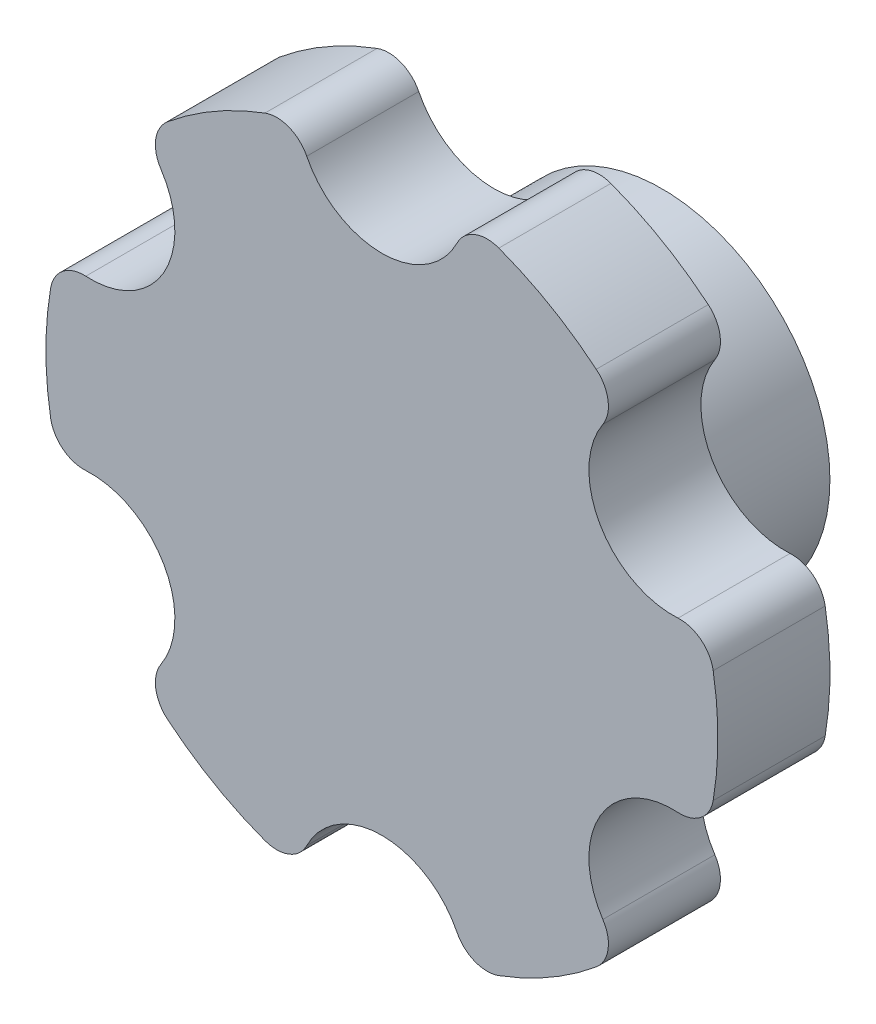
from build123d import *

# Parameters (mm, degrees)
IZIM1_R                        = 15
Y_KSEKLIK_EKSTR_ZYON1_DEPTH    = 15
IZIM2_R                        = 30
Y_KSEKLIK_EKSTR_ZYON2_DEPTH    = 10
IZIM3_R                        = 7.5
KES_EKSTR_ZYON1_DEPTH          = 10
RADYUS1_R                      = 3
DAIRESEL_KAPLAMA3_COUNT        = 6
RADYUS1_OF_DAIRESEL_KAPLAMA3_R = 3
IZIM4_R                        = 4.25
KES_EKSTR_ZYON2_DEPTH          = 15


with BuildPart() as part:
    # Çizim1 → Yükseklik-Ekstrüzyon1 (new body)
    with BuildSketch(Plane.XY):
        Circle(IZIM1_R)
    extrude(amount=Y_KSEKLIK_EKSTR_ZYON1_DEPTH)

    # Çizim2 → Yükseklik-Ekstrüzyon2 (add)
    with BuildSketch(Plane.XY.offset(15)):
        Circle(IZIM2_R)
    extrude(amount=Y_KSEKLIK_EKSTR_ZYON2_DEPTH)

    # Çizim3 → Kes-Ekstrüzyon1 (cut)
    with BuildSketch(Plane.XY.offset(25)):
        with Locations((0, 30)):
            Circle(IZIM3_R)
    kes_ekstr_zyon1 = extrude(amount=-KES_EKSTR_ZYON1_DEPTH, mode=Mode.SUBTRACT)

    # Radyus1
    radyus1_edges = [part.edges().sort_by_distance(p)[0] for p in [
        (7.441175562, 29.0625, 20),
        (-7.441175562, 29.0625, 20),
    ]]
    fillet(radyus1_edges, radius=RADYUS1_R)

    # Dairesel Kaplama3: Kes-Ekstrüzyon1 ×6 about axis
    dairesel_kaplama3_axis = Axis((0, 0, 0), (0, 0, 1))
    for i in range(1, DAIRESEL_KAPLAMA3_COUNT):
        add(kes_ekstr_zyon1.rotate(dairesel_kaplama3_axis, i * 360 / DAIRESEL_KAPLAMA3_COUNT), mode=Mode.SUBTRACT)

    # Radyus1 of Dairesel Kaplama3
    radyus1_of_dairesel_kaplama3_edges = [part.edges().sort_by_distance(p)[0] for p in [
        (-21.448275516, 20.975497071, 20),
        (-28.889451079, 8.087002929, 20),
        (-28.889451079, -8.087002929, 20),
        (-21.448275516, -20.975497071, 20),
        (-7.441175562, -29.0625, 20),
        (7.441175562, -29.0625, 20),
        (21.448275516, -20.975497071, 20),
        (28.889451079, -8.087002929, 20),
        (28.889451079, 8.087002929, 20),
        (21.448275516, 20.975497071, 20),
    ]]
    fillet(radyus1_of_dairesel_kaplama3_edges, radius=RADYUS1_OF_DAIRESEL_KAPLAMA3_R)

    # Çizim4 → Kes-Ekstrüzyon2 (cut)
    with BuildSketch(Plane(origin=(0, 0, 0), x_dir=(-1, 0, 0), z_dir=(0, 0, -1))):
        Circle(IZIM4_R)
    extrude(amount=-KES_EKSTR_ZYON2_DEPTH, mode=Mode.SUBTRACT)


solid = part.part
